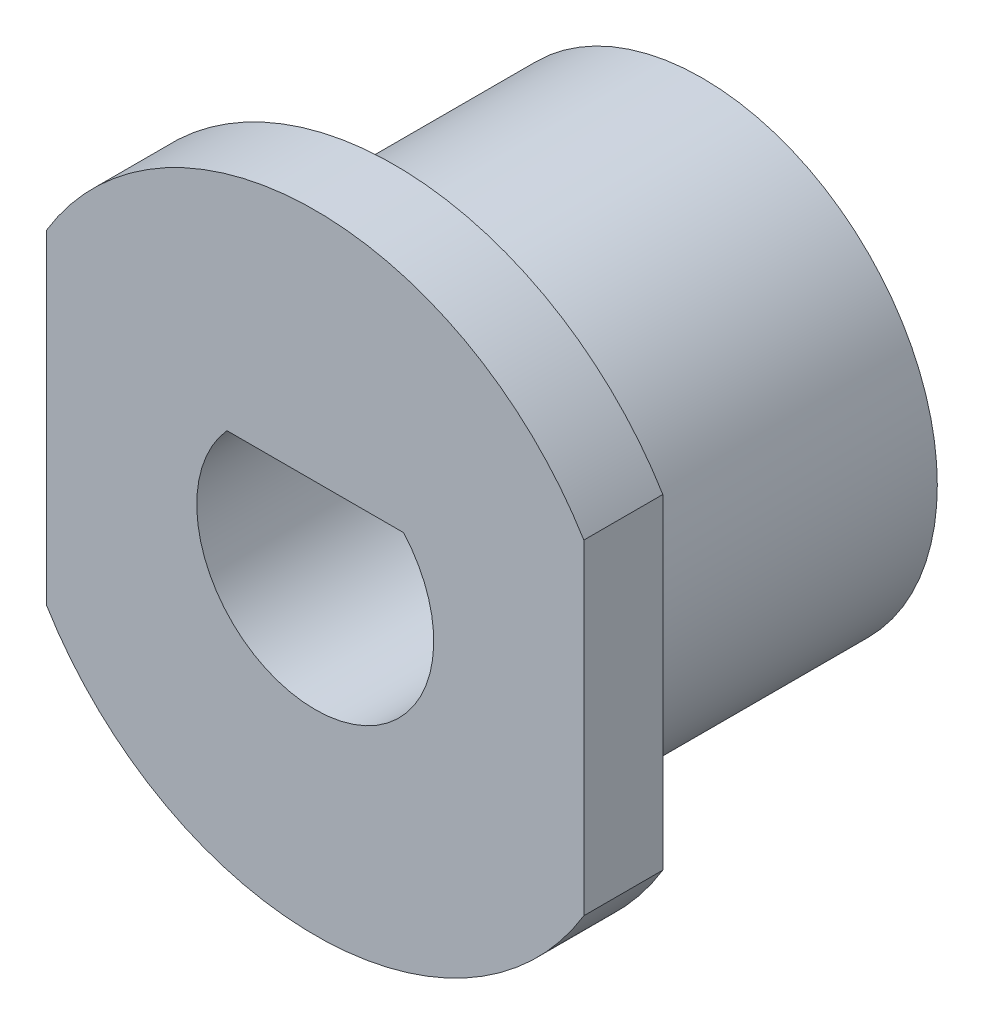
from build123d import *

# Parameters (mm, degrees)
SKETCH1_R           = 2.975
BOSS_EXTRUDE1_DEPTH = 4.9
BOSS_EXTRUDE2_START = -1
SKETCH2_R           = 2.975
BOSS_EXTRUDE2_DEPTH = 1


with BuildPart() as part:
    # Sketch1 → Boss-Extrude1 (new body)
    with BuildSketch(Plane.XY):
        Circle(SKETCH1_R)
        with BuildLine():
            Line((-1.118033989, 1), (1.118033989, 1))
            ThreePointArc((1.118033989, 1), (0, -1.5), (-1.118033989, 1))
        make_face(mode=Mode.SUBTRACT)
    extrude(amount=BOSS_EXTRUDE1_DEPTH)

    # Sketch2 → Boss-Extrude2 (add)
    with BuildSketch(Plane.XY.offset(4.9).offset(BOSS_EXTRUDE2_START)):
        with BuildLine():
            Line((3.4, -2.059277786), (3.4, 2.059277786))
            ThreePointArc((3.4, 2.059277786), (0, 3.975), (-3.4, 2.059277786))
            Line((-3.4, 2.059277786), (-3.4, -2.059277786))
            ThreePointArc((-3.4, -2.059277786), (0, -3.975), (3.4, -2.059277786))
        make_face()
        Circle(SKETCH2_R, mode=Mode.SUBTRACT)
    extrude(amount=BOSS_EXTRUDE2_DEPTH)


solid = part.part
